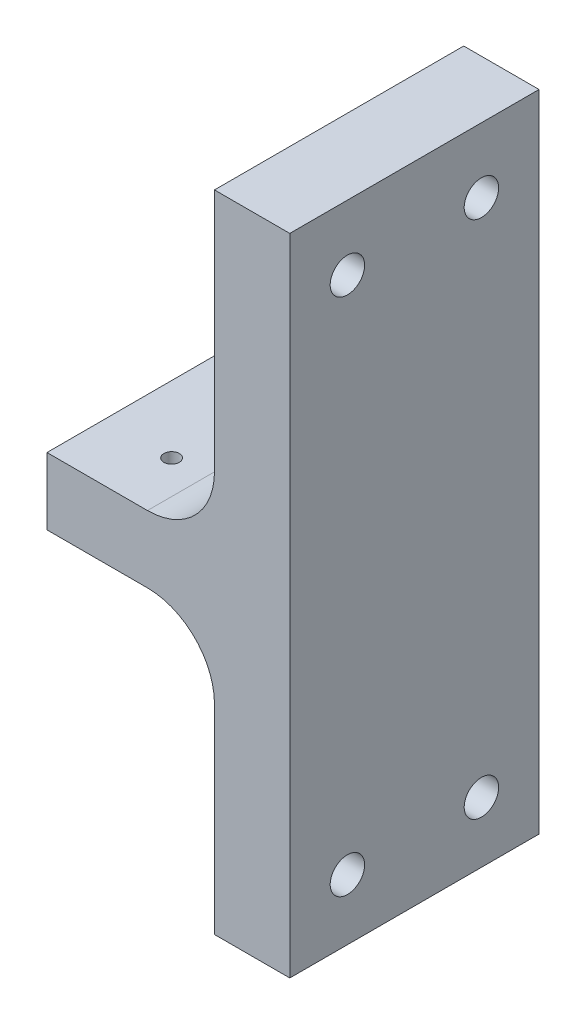
from build123d import *

# Parameters (mm, degrees)
SKETCH1_R           = 1.4605
BOSS_EXTRUDE1_DEPTH = 12.7
BOSS_EXTRUDE2_DEPTH = 14.2748
FILLET1_R           = 12.7
SKETCH3_R           = 3.2639
CUT_EXTRUDE1_DEPTH  = 89.397576146


with BuildPart() as part:
    # Sketch1 → Boss-Extrude1 (new body)
    with BuildSketch(Plane(origin=(0, 0, 0), x_dir=(1, 0, 0), z_dir=(0, 1, 0))):
        Polygon((-12.7, -23.622), (12.7, -23.622), (19.05, -23.622), (19.05, 23.622), (12.7, 23.622), (-12.7, 23.622), align=None)
        with Locations(Location((0, 12.7, 0), (0, 0, 270))):
            Circle(SKETCH1_R, mode=Mode.SUBTRACT)
        with Locations(Location((0, -12.7, 0), (0, 0, 270))):
            Circle(SKETCH1_R, mode=Mode.SUBTRACT)
    extrude(amount=BOSS_EXTRUDE1_DEPTH)

    # Sketch2 → Boss-Extrude2 (add)
    with BuildSketch(Plane(origin=(19.05, 0, 0), x_dir=(0, 0, -1), z_dir=(1, 0, 0))):
        Polygon((-23.622, 0), (-23.622, -50.546), (23.622, -50.546), (23.622, 71.6788), (-23.622, 71.6788), align=None)
    extrude(amount=BOSS_EXTRUDE2_DEPTH)

    # Fillet1
    fillet1_edges = [part.edges().sort_by_distance(p)[0] for p in [
        (19.05, 12.7, 0),
        (19.05, 0, 0),
    ]]
    fillet(fillet1_edges, radius=FILLET1_R)

    # Sketch3 → Cut-Extrude1 (cut, through all)
    with BuildSketch(Plane(origin=(33.3248, 0, 0), x_dir=(0, 0, -1), z_dir=(1, 0, 0))):
        with Locations((-12.7, -39.0398)):
            Circle(SKETCH3_R)
        with Locations((12.7, -39.0398)):
            Circle(SKETCH3_R)
        with Locations((-12.7, 59.3852)):
            Circle(SKETCH3_R)
        with Locations((12.7, 59.3852)):
            Circle(SKETCH3_R)
    extrude(amount=-CUT_EXTRUDE1_DEPTH, mode=Mode.SUBTRACT)


solid = part.part
